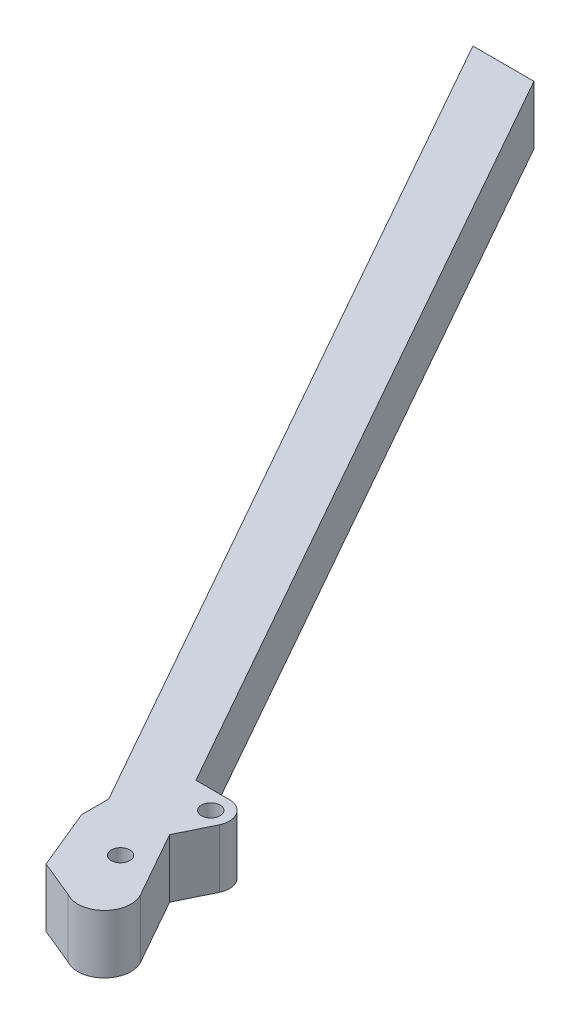
from build123d import *

# Parameters (mm, degrees)
CROQUIS1_R              = 1.75
SALIENTE_EXTRUIR1_DEPTH = 5.5
SALIENTE_EXTRUIR2_DEPTH = 11


with BuildPart() as part:
    # Croquis1 → Saliente-Extruir1 (new, symmetric)
    with BuildSketch(Plane(origin=(0, 0, 0), x_dir=(1, 0, 0), z_dir=(0, 1, 0))):
        with BuildLine():
            Line((-6.9961079, -3.195655599), (-105.176277572, 171.04743403))
            Line((-105.176277572, 171.04743403), (-93.698060534, 171.04743403))
            Line((-93.698060534, 171.04743403), (-11.69265741, 25.510154411))
            Line((-11.69265741, 25.510154411), (-5.393659345, 25.510154411))
            ThreePointArc((-5.393659345, 25.510154411), (-2.426146714, 23.865920772), (-2.246796422, 20.478079431))
            Line((-2.246796422, 20.478079431), (-5.310946382, 14.184353585))
            Line((-5.310946382, 14.184353585), (1.716046582, 1.713352885))
            ThreePointArc((1.716046582, 1.713352885), (-0.185526417, -5.097228597), (-6.9961079, -3.195655599))
        make_face()
        with Locations(Location((-5.393659345, 22.010154411, 0), (0, 0, 270))):
            Circle(CROQUIS1_R, mode=Mode.SUBTRACT)
        with Locations(Location((-6.567237446, 6.228572228, 0), (0, 0, 270))):
            Circle(CROQUIS1_R, mode=Mode.SUBTRACT)
    extrude(amount=SALIENTE_EXTRUIR1_DEPTH, both=True)

    # Croquis3 → Saliente-Extruir2 (add)
    with BuildSketch(Plane(origin=(0, 5.5, 0), x_dir=(1, 0, 0), z_dir=(0, 1, 0))):
        with BuildLine():
            Line((-12.150815645, -2.195736734), (-5.150815645, -5.065033727))
            ThreePointArc((-5.150815645, -5.065033727), (-6.19841412, -4.253687071), (-6.9961079, -3.195655599))
            Line((-6.9961079, -3.195655599), (-16.8311389, 14.258848643))
            Line((-16.8311389, 14.258848643), (-16.837857523, 9.178094271))
            Line((-16.837857523, 9.178094271), (-12.150815645, -2.195736734))
        make_face()
    extrude(amount=-SALIENTE_EXTRUIR2_DEPTH)


solid = part.part
